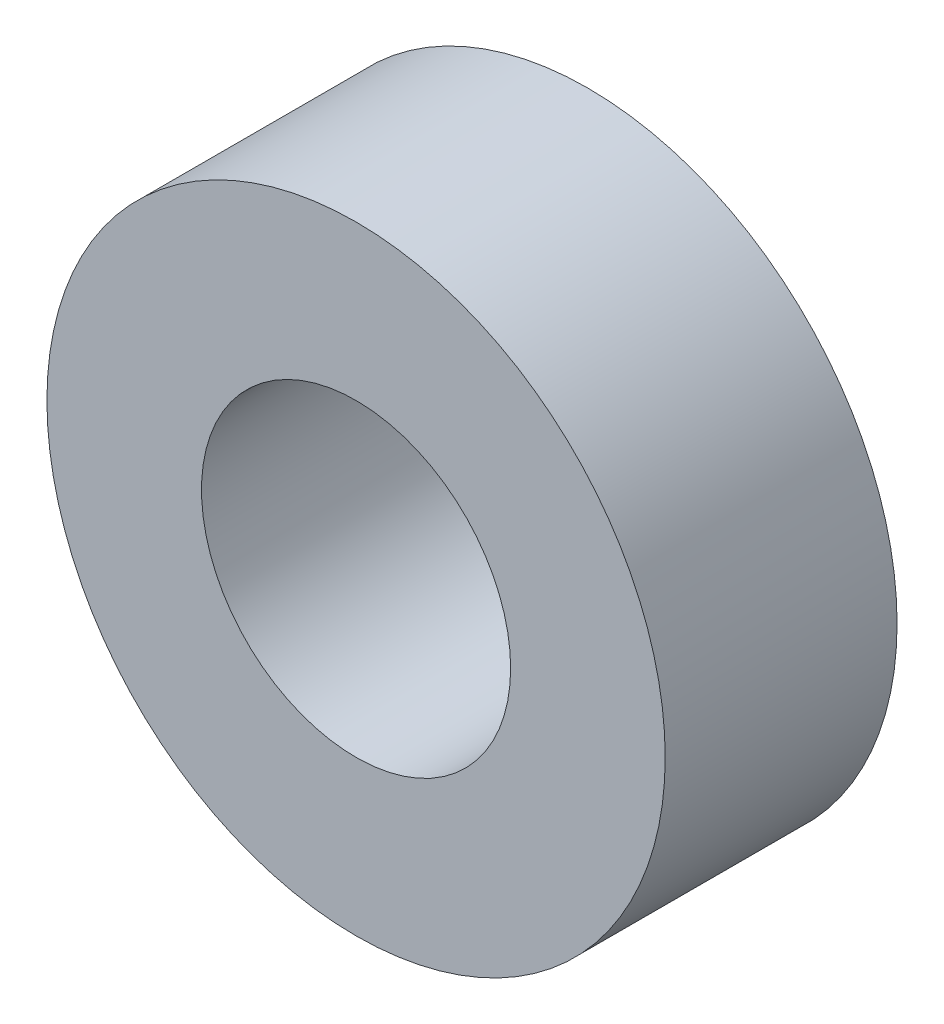
from build123d import *

# Parameters (mm, degrees)
SKETCH1_R               = 6.35
BOSS_EXTRUDE1_DEPTH     = 4.7625
CUT_EXTRUDE1_DEPTH      = 11.164959727
CUT_EXTRUDE1_DEPTH_BACK = 11.164959727
SKETCH2_R               = 3.175


with BuildPart() as part:
    # Sketch1 → Boss-Extrude1 (new body)
    with BuildSketch(Plane.XY):
        with Locations(Location((0, 0, 0), (0, 0, 180))):
            Circle(SKETCH1_R)
    extrude(amount=BOSS_EXTRUDE1_DEPTH)

    # Sketch2 → Cut-Extrude1 (cut, two sides: drawn at the far end of the back side and taken through both)
    with BuildSketch(Plane.XY.offset(4.7625).offset(-CUT_EXTRUDE1_DEPTH_BACK)):
        Circle(SKETCH2_R)
    extrude(amount=CUT_EXTRUDE1_DEPTH + CUT_EXTRUDE1_DEPTH_BACK, mode=Mode.SUBTRACT)


solid = part.part
